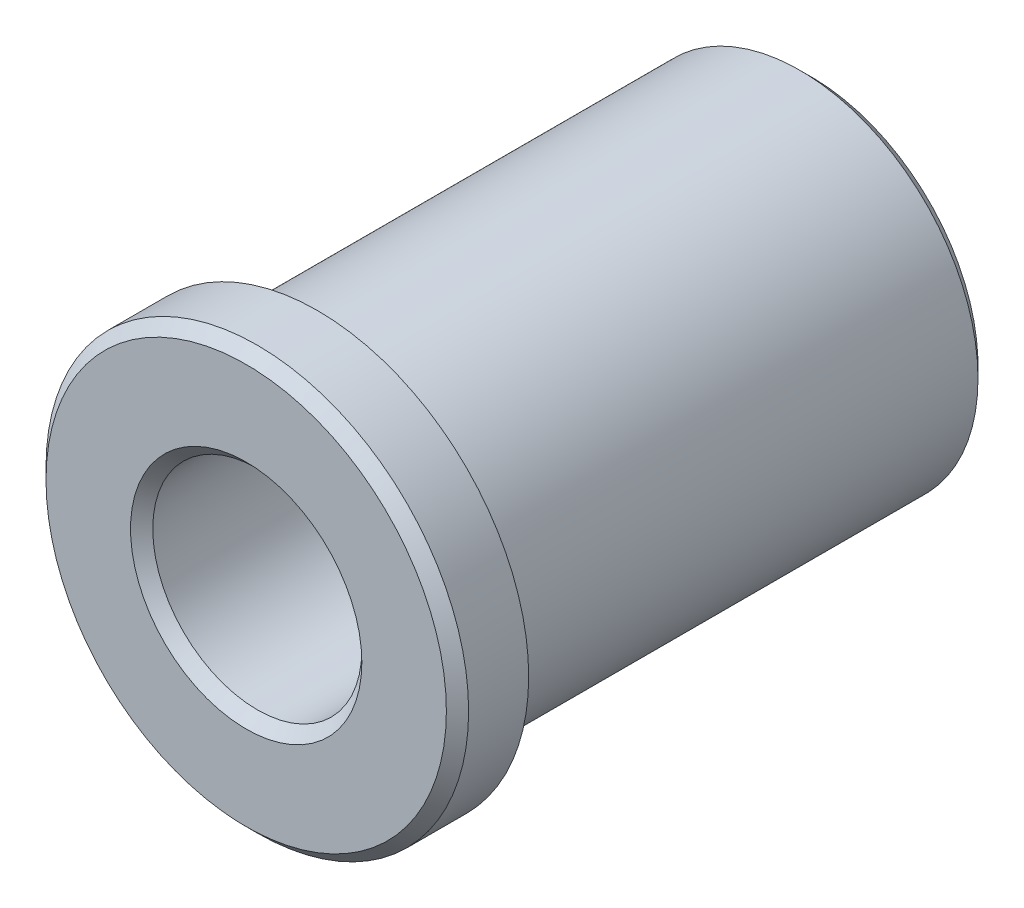
from build123d import *

# Parameters (mm, degrees)
CHAMFER1_SIZE = 0.25


with BuildPart() as part:
    # Sketch6 → Revolve1 (revolve)
    with BuildSketch(Plane(origin=(0, 0, 0), x_dir=(1, 0, 0), z_dir=(0, 1, 0))):
        Polygon((2.35, 0), (4.75, 0), (4.75, 1.6), (4, 1.6), (4, 12.7), (2.35, 12.7), align=None)
    revolve(axis=Axis((0, 0, 0), (0, 0, -1)))

    # Chamfer1
    chamfer1_edges = [part.edges().sort_by_distance(p)[0] for p in [
        (-2.35, 0, -12.7),
        (-4, 0, -12.7),
        (-4.75, 0, 0),
        (-2.35, 0, 0),
    ]]
    chamfer(chamfer1_edges, length=CHAMFER1_SIZE)


solid = part.part
